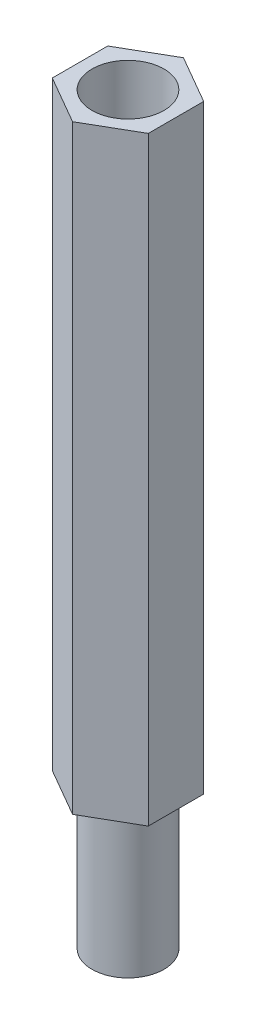
from build123d import *

# Parameters (mm, degrees)
BOSS_EXTRUDE1_DEPTH = 25
SKETCH2_R           = 1.5
CUT_EXTRUDE1_DEPTH  = 19
SKETCH3_R           = 1.5
BOSS_EXTRUDE2_DEPTH = 6


with BuildPart() as part:
    # Sketch1 → Boss-Extrude1 (new body)
    with BuildSketch(Plane(origin=(0, 0, 0), x_dir=(1, 0, 0), z_dir=(0, 1, 0))):
        Polygon((0, -2.309401077), (2, -1.154700538), (2, 1.154700538), (0, 2.309401077), (-2, 1.154700538), (-2, -1.154700538), align=None)
    extrude(amount=BOSS_EXTRUDE1_DEPTH)

    # Sketch2 → Cut-Extrude1 (cut)
    with BuildSketch(Plane(origin=(0, 25, 0), x_dir=(1, 0, 0), z_dir=(0, 1, 0))):
        with Locations(Location((0, 0, 0), (0, 0, 270))):
            Circle(SKETCH2_R)
    extrude(amount=-CUT_EXTRUDE1_DEPTH, mode=Mode.SUBTRACT)

    # Sketch3 → Boss-Extrude2 (add)
    with BuildSketch(Plane.XZ):
        with Locations(Location((0, 0, 0), (0, 0, 90))):
            Circle(SKETCH3_R)
    extrude(amount=BOSS_EXTRUDE2_DEPTH)


solid = part.part
